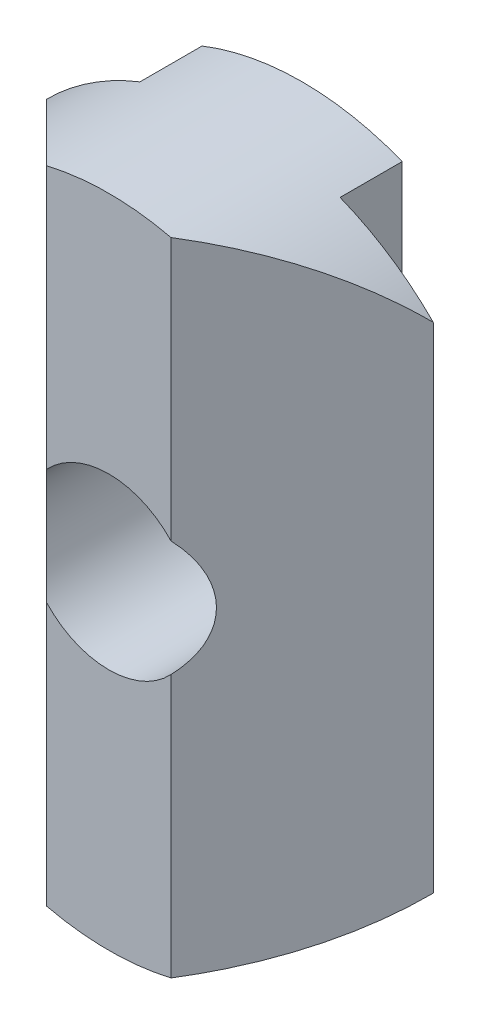
from build123d import *

# Parameters (mm, degrees)
BOSS_EXTRU_1_DEPTH      = 4.75
ESQUISSE1_OUTSIDE_W     = 9.876
ESQUISSE1_OUTSIDE_H     = 13.776
ENL_V_MAT_EXTRU_1_DEPTH = 7.18405207
TROU_TARAUD_M31_D       = 2.45875


with BuildPart() as part:
    # Esquisse2 → Boss.-Extru.1 (new, symmetric)
    with BuildSketch(Plane(origin=(0, 0, 0), x_dir=(1, 0, 0), z_dir=(0, 1, 0))):
        Polygon((0.9, 0), (2.8, 1.9), (1.45, 1.9), (1.45, 2.8), (-1.45, 2.8), (-1.45, 1.9), (-2.8, 1.9), (-0.9, 0), align=None)
    extrude(amount=BOSS_EXTRU_1_DEPTH, both=True)

    # Esquisse1 outside → Enlèv. mat.-Extru.1 (cut, through all)
    with BuildSketch(Plane.XY):
        Rectangle(ESQUISSE1_OUTSIDE_W, ESQUISSE1_OUTSIDE_H)
        with BuildLine():
            Line((-2.8, -3.581739419), (-2.8, 3.581739419))
            ThreePointArc((-2.8, 3.581739419), (0, 4.75), (2.8, 3.581739419))
            Line((2.8, 3.581739419), (2.8, -3.581739419))
            ThreePointArc((2.8, -3.581739419), (0, -4.75), (-2.8, -3.581739419))
        make_face(mode=Mode.SUBTRACT)
    extrude(amount=-ENL_V_MAT_EXTRU_1_DEPTH, mode=Mode.SUBTRACT)

    # Trou taraudé M31 (through all)
    with Locations(Plane(origin=(0, 0, -2.8), x_dir=(-1, 0, 0), z_dir=(0, 0, -1))):
        with Locations((0, 0)):
            Hole(TROU_TARAUD_M31_D / 2)


solid = part.part
